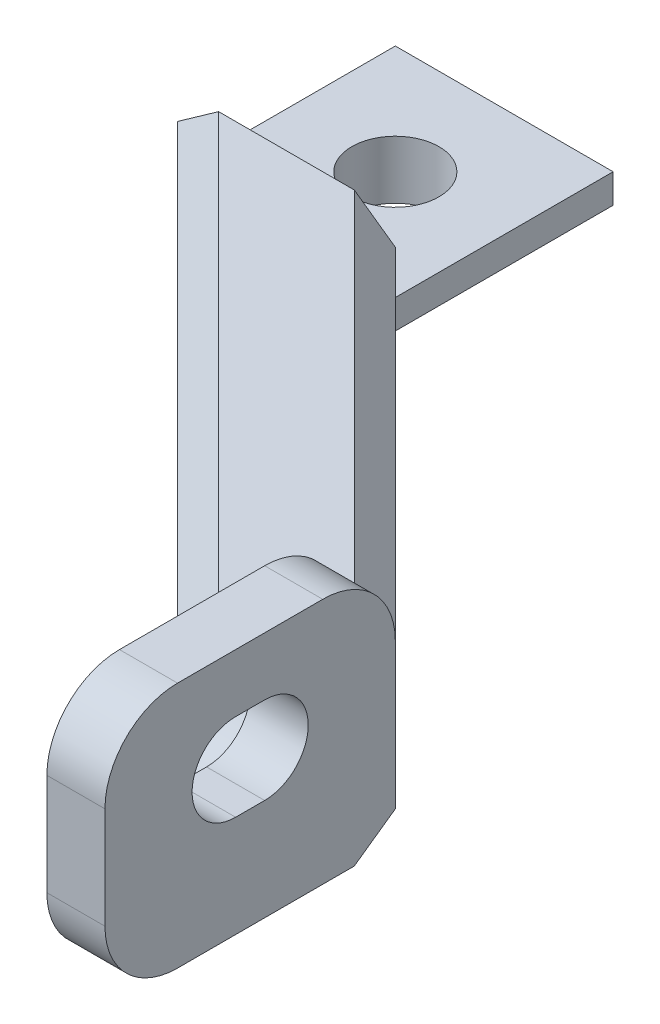
from build123d import *

# Parameters (mm, degrees)
BOSS_EXTRUDE1_DEPTH = 9
SKETCH2_W           = 4
SKETCH2_H           = 20
BOSS_EXTRUDE2_DEPTH = 17
SKETCH3_W           = 15
SKETCH3_H           = 5
CUT_EXTRUDE1_DEPTH  = 66.094162565
SKETCH4_R           = 3
CUT_EXTRUDE2_DEPTH  = 68.830671528
CUT_EXTRUDE3_DEPTH  = 73.919476136
CUT_EXTRUDE4_DEPTH  = 71.606302835
FILLET1_R           = 5
CHAMFER1_SIZE       = 2


with BuildPart() as part:
    # Sketch1 → Boss-Extrude1 (new body)
    with BuildSketch(Plane(origin=(0, 0, 0), x_dir=(1, 0, 0), z_dir=(0, 1, 0))):
        Polygon((7.5, -7.5), (36, -36), (36, -51), (-7.5, -7.5), (-7.5, 7.5), (7.5, 7.5), align=None)
    extrude(amount=BOSS_EXTRUDE1_DEPTH)

    # Sketch2 → Boss-Extrude2 (add)
    with BuildSketch(Plane.XZ):
        with Locations((34, 46)):
            Rectangle(SKETCH2_W, SKETCH2_H)
    extrude(amount=-BOSS_EXTRUDE2_DEPTH)

    # Sketch3 → Cut-Extrude1 (cut, through all)
    with BuildSketch(Plane(origin=(7.5, 0, 0), x_dir=(0, 0, -1), z_dir=(1, 0, 0))):
        with Locations((0, 6.5)):
            Rectangle(SKETCH3_W, SKETCH3_H)
    extrude(amount=-CUT_EXTRUDE1_DEPTH, mode=Mode.SUBTRACT)

    # Sketch4 → Cut-Extrude2 (cut, through all)
    with BuildSketch(Plane(origin=(0, 4, 0), x_dir=(1, 0, 0), z_dir=(0, 1, 0))):
        with Locations(Location((0, 0, 0), (0, 0, 270))):
            Circle(SKETCH4_R)
    extrude(amount=-CUT_EXTRUDE2_DEPTH, mode=Mode.SUBTRACT)

    # Sketch5 → Cut-Extrude3 (cut, through all)
    with BuildSketch(Plane(origin=(36, 0, 0), x_dir=(0, 0, -1), z_dir=(1, 0, 0))):
        with BuildLine():
            Line((-45, 7), (-47, 7))
            ThreePointArc((-47, 7), (-50, 10), (-47, 13))
            Line((-47, 13), (-45, 13))
            ThreePointArc((-45, 13), (-42, 10), (-45, 7))
        make_face()
    extrude(amount=-CUT_EXTRUDE3_DEPTH, mode=Mode.SUBTRACT)

    # Sketch6 → Cut-Extrude4 (cut, through all)
    with BuildSketch(Plane.ZY.offset(-32)):
        with BuildLine():
            Line((47, 5), (45, 5))
            ThreePointArc((45, 5), (42.113248654, 5.917517095), (40.285954792, 8.333333333))
            ThreePointArc((40.285954792, 8.333333333), (40.917517095, 12.886751346), (45, 15))
            Line((45, 15), (47, 15))
            ThreePointArc((47, 15), (51.082482905, 12.886751346), (51.714045208, 8.333333333))
            ThreePointArc((51.714045208, 8.333333333), (49.886751346, 5.917517095), (47, 5))
        make_face()
        with BuildLine():
            Line((47, 7), (45, 7))
            ThreePointArc((45, 7), (43.267949192, 7.550510257), (42.171572875, 9))
            ThreePointArc((42.171572875, 9), (42.550510257, 11.732050808), (45, 13))
            Line((45, 13), (47, 13))
            ThreePointArc((47, 13), (49.449489743, 11.732050808), (49.828427125, 9))
            ThreePointArc((49.828427125, 9), (48.732050808, 7.550510257), (47, 7))
        make_face(mode=Mode.SUBTRACT)
    extrude(amount=CUT_EXTRUDE4_DEPTH, mode=Mode.SUBTRACT)

    # Fillet1
    fillet1_edges = [part.edges().sort_by_distance(p)[0] for p in [
        (34, 0, 56),
        (34, 17, 36),
        (34, 17, 56),
    ]]
    fillet(fillet1_edges, radius=FILLET1_R)

    # Chamfer1
    chamfer1_edges = [part.edges().sort_by_distance(p)[0] for p in [
        (21.75, 0, 21.75),
        (7.5, 0, 0),
        (0, 0, -7.5),
        (-7.5, 0, 0),
        (12.25, 0, 27.25),
        (8.800510257, 9, 23.800510257),
        (21.75, 9, 21.75),
    ]]
    chamfer(chamfer1_edges, length=CHAMFER1_SIZE)


solid = part.part
